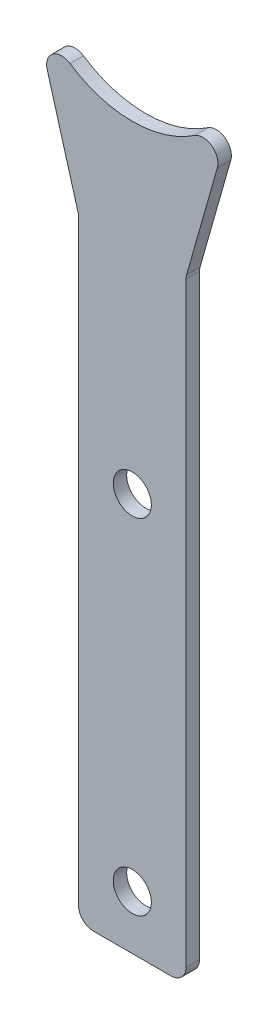
from build123d import *

# Parameters (mm, degrees)
SKETCH1_R            = 2.625
BOSS_EXTRUDE1_DEPTH  = 1.5875
FILLET1_R            = 1.778
M4_CLEARANCE_HOLE1_D = 4.5


with BuildPart() as part:
    # Sketch1 → Boss-Extrude1 (new body)
    # profile 1 of 3: a face of its own
    with BuildSketch(Plane.XY):
        with BuildLine():
            ThreePointArc((-14.144818028, 67.686446389), (-1.442639673, 58.098657577), (11.259538681, 67.686446389))
            Line((11.259538681, 67.686446389), (4.907360327, 45.398657577))
            Line((4.907360327, 45.398657577), (4.907360327, -26.991342423))
            Line((4.907360327, -26.991342423), (-7.792639673, -26.991342423))
            Line((-7.792639673, -26.991342423), (-7.792639673, 45.398657577))
            Line((-7.792639673, 45.398657577), (-14.144818028, 67.686446389))
        make_face()
        with Locations((-1.442639673, -20.641342423)):
            Circle(SKETCH1_R, mode=Mode.SUBTRACT)
        with Locations((-1.442639673, 19.998657577)):
            Circle(SKETCH1_R, mode=Mode.SUBTRACT)
    # profile 2 of 3: a face of its own
    with BuildSketch(Plane.XY):
        with Locations((-1.442639673, 19.998657577)):
            Circle(SKETCH1_R)
    # profile 3 of 3: a face of its own
    with BuildSketch(Plane.XY):
        with Locations((-1.442639673, -20.641342423)):
            Circle(SKETCH1_R)
    extrude(amount=BOSS_EXTRUDE1_DEPTH)

    # Fillet1
    fillet1_edges = [part.edges().sort_by_distance(p)[0] for p in [
        (11.259538681, 67.686446389, 0.79375),
        (4.907360327, 45.398657577, 0.79375),
        (4.907360327, -26.991342423, 0.79375),
        (-7.792639673, -26.991342423, 0.79375),
        (-7.792639673, 45.398657577, 0.79375),
        (-14.144818028, 67.686446389, 0.79375),
    ]]
    fillet(fillet1_edges, radius=FILLET1_R)

    # M4 Clearance Hole1 (through all)
    with Locations(Plane.XY.offset(1.5875)):
        with Locations((-1.442639673, -20.641342423), (-1.442639673, 19.998657577)):
            Hole(M4_CLEARANCE_HOLE1_D / 2)


solid = part.part
